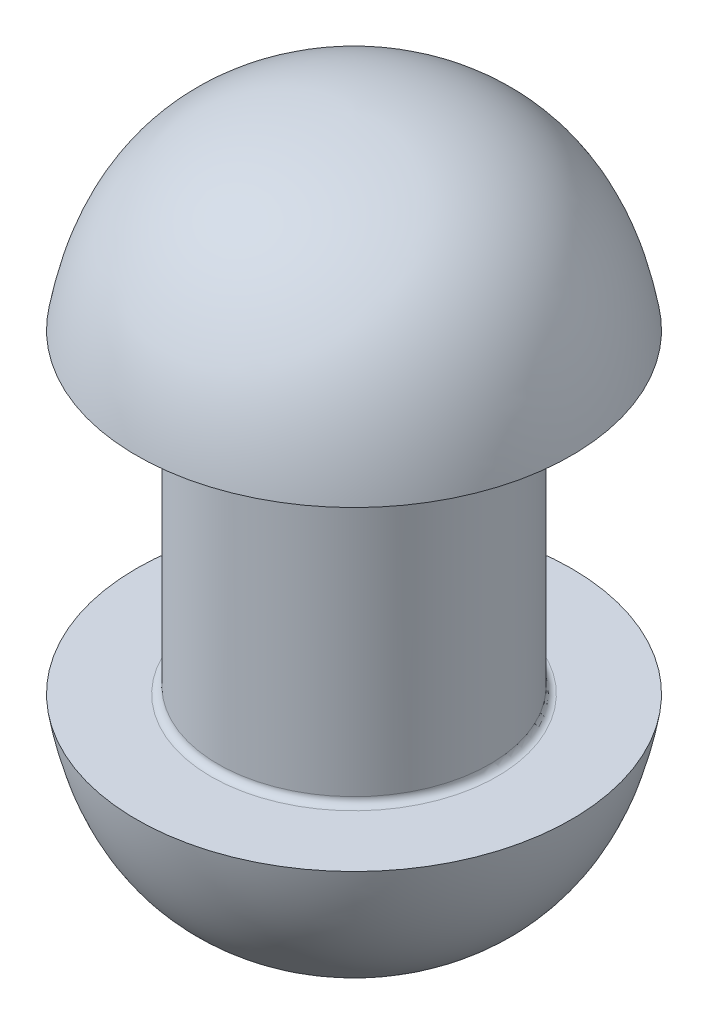
from build123d import *

# Parameters (mm, degrees)
SKETCH1_R           = 9.486832981
BOSS_EXTRUDE1_DEPTH = 11
FILLET1_R           = 0.5


with BuildPart() as part:
    # Sketch1 → Boss-Extrude1 (new body)
    with BuildSketch(Plane(origin=(0, 0, 0), x_dir=(1, 0, 0), z_dir=(0, 1, 0))):
        with Locations(Location((0, 0, 0), (0, 0, 270))):
            Circle(SKETCH1_R)
    boss_extrude1 = extrude(amount=BOSS_EXTRUDE1_DEPTH)

    # Sketch2 → Revolve1 (revolve)
    with BuildSketch(Plane.XY):
        with BuildLine():
            Line((0, 24.281566173), (0, 11))
            Line((0, 11), (-15.178932769, 11))
            add(Edge.make_bspline(
                [(0, 24.281566173), (-13.015575695, 23.967255227), (-15.178932769, 11)],
                knots=[0, 0, 0, 1, 1, 1], degree=2))
        make_face()
    revolve1 = revolve(axis=Axis((0, 0, 0), (0, 1, 0)))

    # Mirror1: Boss-Extrude1, Revolve1 across plane
    add(boss_extrude1.mirror(Plane.ZX))
    add(revolve1.mirror(Plane.ZX))

    # Fillet1
    fillet1_edges = [part.edges().sort_by_distance(p)[0] for p in [
        (0, -11, -9.486832981),
        (0, 11, -9.486832981),
    ]]
    fillet(fillet1_edges, radius=FILLET1_R)


solid = part.part
